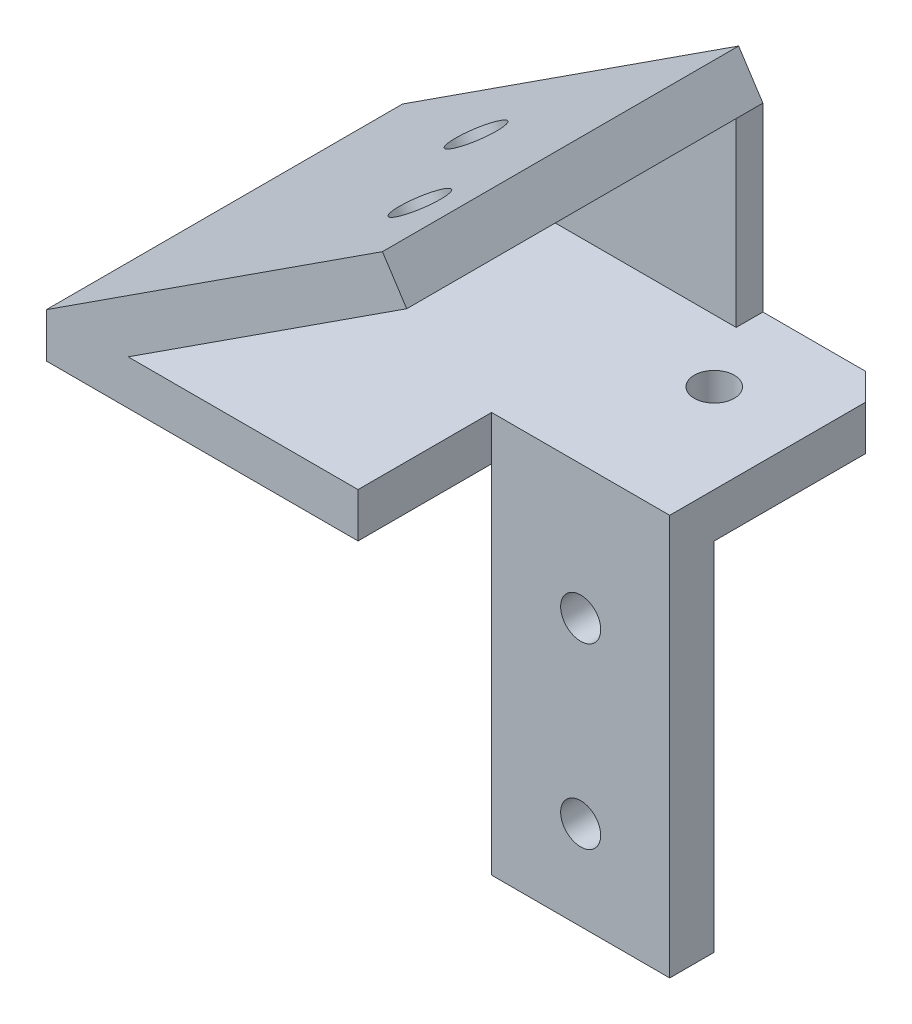
from build123d import *

# Parameters (mm, degrees)
SKETCH1_W           = 20
SKETCH1_H           = 20
SKETCH1_R           = 2.25
BOSS_EXTRUDE1_DEPTH = 5
SKETCH2_W           = 20
SKETCH2_H           = 45
SKETCH2_R           = 2.25
BOSS_EXTRUDE2_DEPTH = 5
CHAMFER1_SIZE       = 3
SKETCH3_W           = 40
SKETCH3_H           = 5
BOSS_EXTRUDE3_DEPTH = 35
BOSS_EXTRUDE4_DEPTH = 40
BOSS_EXTRUDE5_DEPTH = 3
CUT_EXTRUDE1_REACH  = 72.766
SKETCH6_R           = 2.75


with BuildPart() as part:
    # Sketch1 → Boss-Extrude1 (new body)
    with BuildSketch(Plane(origin=(0, 0, 0), x_dir=(1, 0, 0), z_dir=(0, 1, 0))):
        with Locations((10, 10)):
            Rectangle(SKETCH1_W, SKETCH1_H)
        with Locations((10, 10)):
            Circle(SKETCH1_R, mode=Mode.SUBTRACT)
    extrude(amount=BOSS_EXTRUDE1_DEPTH)

    # Sketch2 → Boss-Extrude2 (add)
    with BuildSketch(Plane.XY):
        with Locations((10, -17.5)):
            Rectangle(SKETCH2_W, SKETCH2_H)
        with Locations((10, -30)):
            Circle(SKETCH2_R, mode=Mode.SUBTRACT)
        with Locations((10, -10)):
            Circle(SKETCH2_R, mode=Mode.SUBTRACT)
    extrude(amount=BOSS_EXTRUDE2_DEPTH)

    # Chamfer1
    chamfer1_edges = [part.edges().sort_by_distance(p)[0] for p in [
        (20, 2.5, -20),
    ]]
    chamfer(chamfer1_edges, length=CHAMFER1_SIZE)

    # Sketch3 → Boss-Extrude3 (add)
    with BuildSketch(Plane.ZY):
        with Locations((0, 2.5)):
            Rectangle(SKETCH3_W, SKETCH3_H)
    extrude(amount=BOSS_EXTRUDE3_DEPTH)

    # Sketch4 → Boss-Extrude4 (add)
    with BuildSketch(Plane.XY.offset(20)):
        Polygon((-35, 5), (2.740175558, 29.508756576), (5.463370733, 25.315403736), (-25.819607706, 5), align=None)
    extrude(amount=-BOSS_EXTRUDE4_DEPTH)

    # Sketch5 → Boss-Extrude5 (add)
    with BuildSketch(Plane(origin=(0, 0, -20), x_dir=(-1, 0, 0), z_dir=(0, 0, -1))):
        Polygon((-5.463370733, 25.315403736), (-5.463370733, 5), (25.819607706, 5), align=None)
    extrude(amount=-BOSS_EXTRUDE5_DEPTH)

    # Sketch6 → Cut-Extrude1 (cut, up to next)
    with BuildSketch(Plane(origin=(-12.66597239, 19.503887116, 0), x_dir=(0.8386705679454272, 0.5446390350150224, 0), z_dir=(-0.5446390350150224, 0.8386705679454272, 0)), mode=Mode.PRIVATE) as cut_extrude1_sk1:
        with Locations((9.369725297, -8.25)):
            Circle(SKETCH6_R)
    cut_extrude1_tool1 = extrude(cut_extrude1_sk1.sketch, amount=-CUT_EXTRUDE1_REACH, mode=Mode.PRIVATE) & part.part
    # Sketch6 → Cut-Extrude1 (cut, up to next)
    with BuildSketch(Plane(origin=(-12.66597239, 19.503887116, 0), x_dir=(0.8386705679454272, 0.5446390350150224, 0), z_dir=(-0.5446390350150224, 0.8386705679454272, 0)), mode=Mode.PRIVATE) as cut_extrude1_sk2:
        with Locations((-2.480274703, 8)):
            Circle(SKETCH6_R)
    cut_extrude1_tool2 = extrude(cut_extrude1_sk2.sketch, amount=-CUT_EXTRUDE1_REACH, mode=Mode.PRIVATE) & part.part
    add(cut_extrude1_tool1.solids().sort_by_distance((-4.80786, 24.607005, 8.25))[0], mode=Mode.SUBTRACT)
    add(cut_extrude1_tool2.solids().sort_by_distance((-14.746106, 18.153033, -8))[0], mode=Mode.SUBTRACT)


solid = part.part
